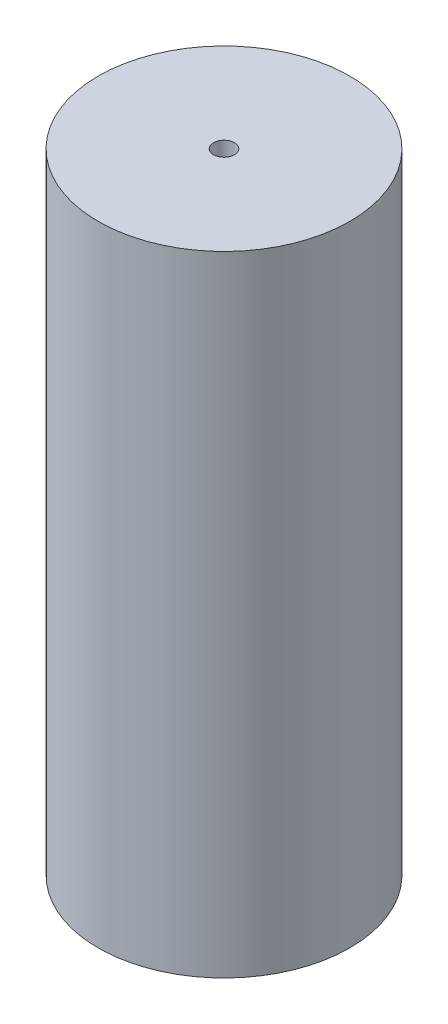
from build123d import *

# Parameters (mm, degrees)
SKETCH2_R          = 0.25
CUT_EXTRUDE1_DEPTH = 16.588457268


with BuildPart() as part:
    # Sketch1 → Revolve1 (revolve)
    with BuildSketch(Plane.XY, mode=Mode.PRIVATE) as revolve1_sk:
        Polygon((0, 15), (-3, 15), (-3, 0), (-2, 0), (-2, 12), (0, 12), align=None)
    revolve(revolve1_sk.sketch.rotate(Axis((0, 0, 0), (0, 1, 0)), 180), axis=Axis((0, 0, 0), (0, 1, 0)))

    # Sketch2 → Cut-Extrude1 (cut, through all)
    with BuildSketch(Plane(origin=(0, 15, 0), x_dir=(1, 0, 0), z_dir=(0, 1, 0))):
        with Locations(Location((0, 0, 0), (0, 0, 180))):
            Circle(SKETCH2_R)
    extrude(amount=-CUT_EXTRUDE1_DEPTH, mode=Mode.SUBTRACT)


solid = part.part
